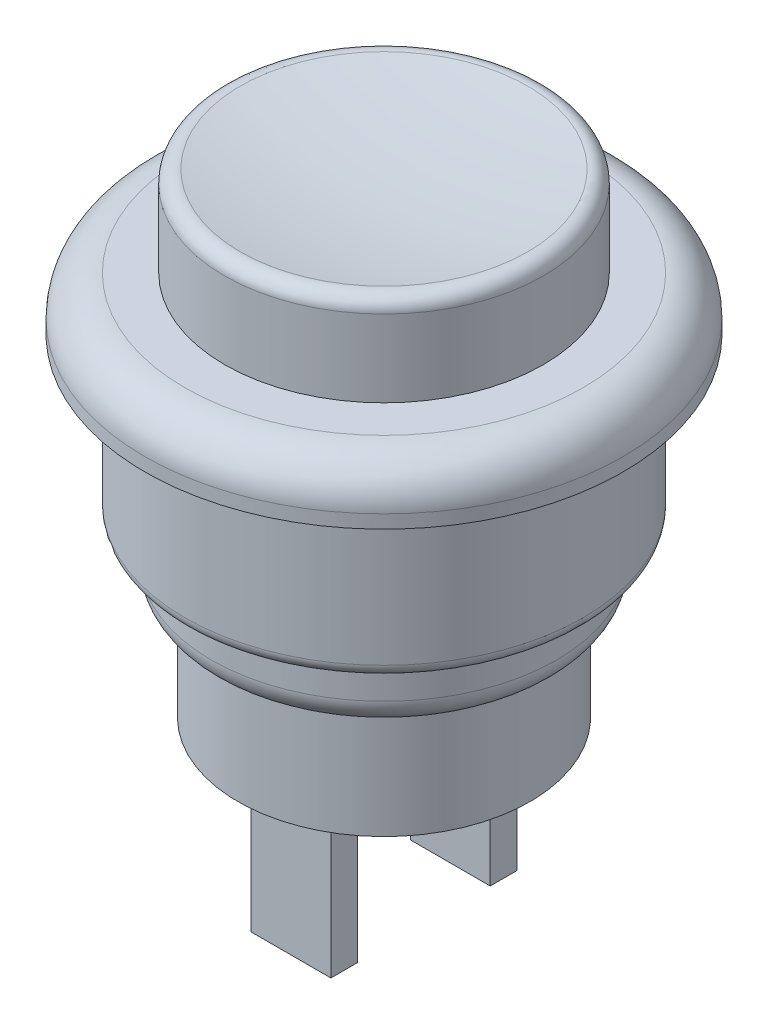
from build123d import *

# Parameters (mm, degrees)
FILLET1_R           = 1.5
FILLET2_R           = 0.5
FILLET3_R           = 1
FILLET4_R           = 0.5
SKETCH2_W           = 3
SKETCH2_H           = 1
BOSS_EXTRUDE1_DEPTH = 6


with BuildPart() as part:
    # Sketch1 → Revolve1 (revolve)
    with BuildSketch(Plane.XY, mode=Mode.PRIVATE) as revolve1_sk:
        with BuildLine():
            Line((6, 9), (6, 5.5))
            Line((6, 5.5), (9, 5.5))
            Line((9, 5.5), (9, 3.5))
            Line((9, 3.5), (7.5, 3.5))
            Line((7.5, 3.5), (7.5, -2.5))
            Line((7.5, -2.5), (6.5, -2.5))
            Line((6.5, -2.5), (6.5, -4.5))
            Line((6.5, -4.5), (5.5, -5))
            Line((5.5, -5), (5.5, -9))
            Line((5.5, -9), (0, -9))
            Line((0, -9), (0, 8.396096516))
            ThreePointArc((0, 8.396096516), (3.015157517, 8.547452829), (6, 9))
        make_face()
    revolve(revolve1_sk.sketch.rotate(Axis((0, -9, 0), (0, 1, 0)), 90), axis=Axis((0, -9, 0), (0, 1, 0)))

    # Fillet1
    fillet1_edges = [part.edges().sort_by_distance(p)[0] for p in [
        (0, 5.5, 9),
    ]]
    fillet(fillet1_edges, radius=FILLET1_R)

    # Fillet2
    fillet2_edges = [part.edges().sort_by_distance(p)[0] for p in [
        (0, 9, 6),
    ]]
    fillet(fillet2_edges, radius=FILLET2_R)

    # Fillet3
    fillet3_edges = [part.edges().sort_by_distance(p)[0] for p in [
        (0, -4.5, 6.5),
    ]]
    fillet(fillet3_edges, radius=FILLET3_R)

    # Fillet4
    fillet4_edges = [part.edges().sort_by_distance(p)[0] for p in [
        (0, -2.5, 7.5),
    ]]
    fillet(fillet4_edges, radius=FILLET4_R)

    # Sketch2 → Boss-Extrude1 (add)
    with BuildSketch(Plane.XZ.offset(9)):
        with Locations((0, 3)):
            Rectangle(SKETCH2_W, SKETCH2_H)
        with Locations((0, -3)):
            Rectangle(SKETCH2_W, SKETCH2_H)
    extrude(amount=BOSS_EXTRUDE1_DEPTH)


solid = part.part
